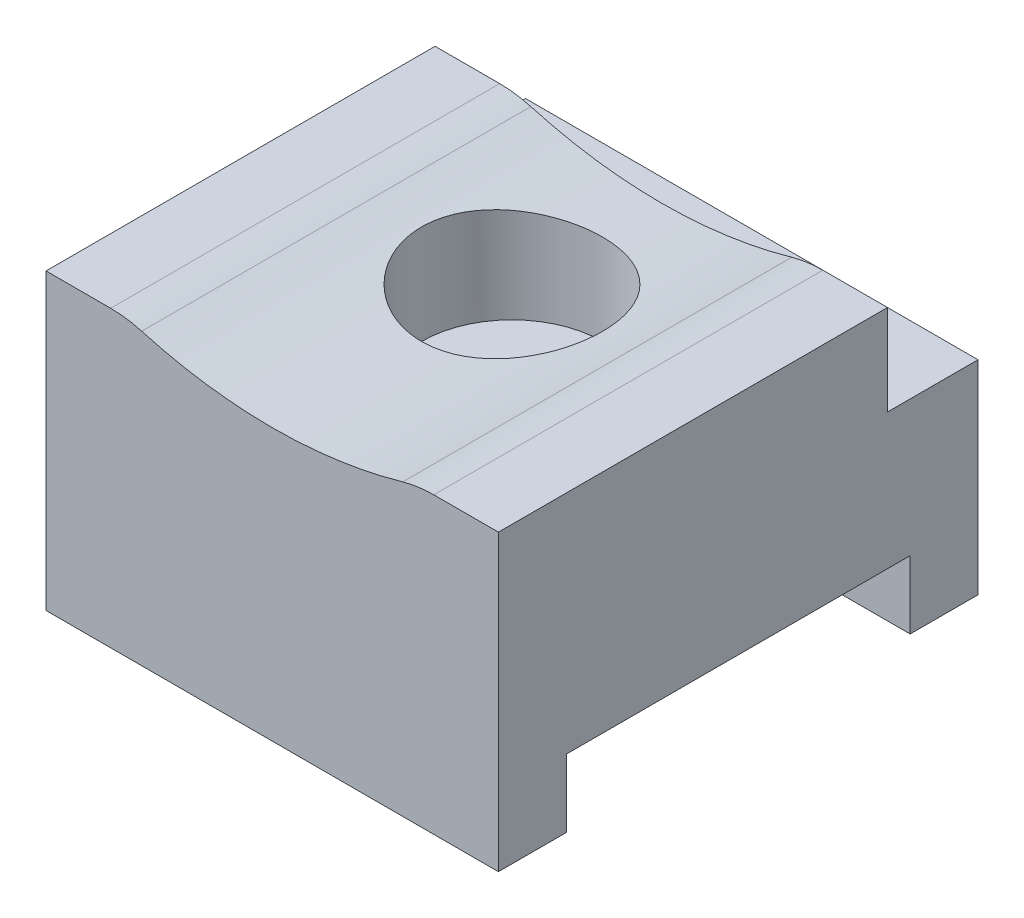
from build123d import *

# Parameters (mm, degrees)
EXTRUDE_1_DEPTH     = 20
SKETCH_2_R          = 21
CUT_EXTRUDE_1_DEPTH = 31.812984276
SKETCH_3_R          = 1.6
CUT_EXTRUDE_2_DEPTH = 25.745908753
SKETCH_4_R          = 4
CUT_EXTRUDE_3_DEPTH = 25.007498873
FILLET_1_R          = 5
SKETCH_5_W          = 4
SKETCH_5_H          = 4
CUT_EXTRUDE_4_DEPTH = 25.745908796
SKETCH_6_R          = 4
CUT_EXTRUDE_5_DEPTH = 1


with BuildPart() as part:
    # 草图1 → 凸台-拉伸1 (new body)
    with BuildSketch(Plane(origin=(0, 0, 0), x_dir=(0, 0, -1), z_dir=(1, 0, 0))):
        Polygon((-10.6, 10), (10.6, 10), (10.6, -3), (7.6, -3), (7.6, 0), (-7.6, 0), (-7.6, -3), (-10.6, -3), align=None)
    extrude(amount=EXTRUDE_1_DEPTH)

    # 草图2 → 切除-拉伸1 (cut, through all)
    with BuildSketch(Plane.XY.offset(10.6)):
        with Locations((10, 30)):
            Circle(SKETCH_2_R)
    extrude(amount=-CUT_EXTRUDE_1_DEPTH, mode=Mode.SUBTRACT)

    # 草图3 → 切除-拉伸2 (cut, through all)
    with BuildSketch(Plane.XZ):
        with Locations(Location((10, 0, 0), (0, 0, 270))):
            Circle(SKETCH_3_R)
    extrude(amount=-CUT_EXTRUDE_2_DEPTH, mode=Mode.SUBTRACT)

    # 草图4 → 切除-拉伸3 (cut, through all)
    with BuildSketch(Plane(origin=(0, 5, 0), x_dir=(-1, 0, 0), z_dir=(0, -1, 0))):
        with Locations(Location((-10, 0, 0), (0, 0, 90))):
            Circle(SKETCH_4_R)
    extrude(amount=-CUT_EXTRUDE_3_DEPTH, mode=Mode.SUBTRACT)

    # 圆角1
    fillet_1_edges = [part.edges().sort_by_distance(p)[0] for p in [
        (16.403124237, 10, 0),
        (3.596875763, 10, 0),
    ]]
    fillet(fillet_1_edges, radius=FILLET_1_R)

    # 草图5 → 切除-拉伸4 (cut, through all)
    with BuildSketch(Plane(origin=(20, 0, 0), x_dir=(0, 0, -1), z_dir=(1, 0, 0))):
        with Locations((8.6, 8)):
            Rectangle(SKETCH_5_W, SKETCH_5_H)
    extrude(amount=-CUT_EXTRUDE_4_DEPTH, mode=Mode.SUBTRACT)

    # 草图6 → 切除-拉伸5 (cut)
    with BuildSketch(Plane.XZ):
        with Locations(Location((10, 0, 0), (0, 0, 270))):
            Circle(SKETCH_6_R)
    extrude(amount=-CUT_EXTRUDE_5_DEPTH, mode=Mode.SUBTRACT)


solid = part.part
